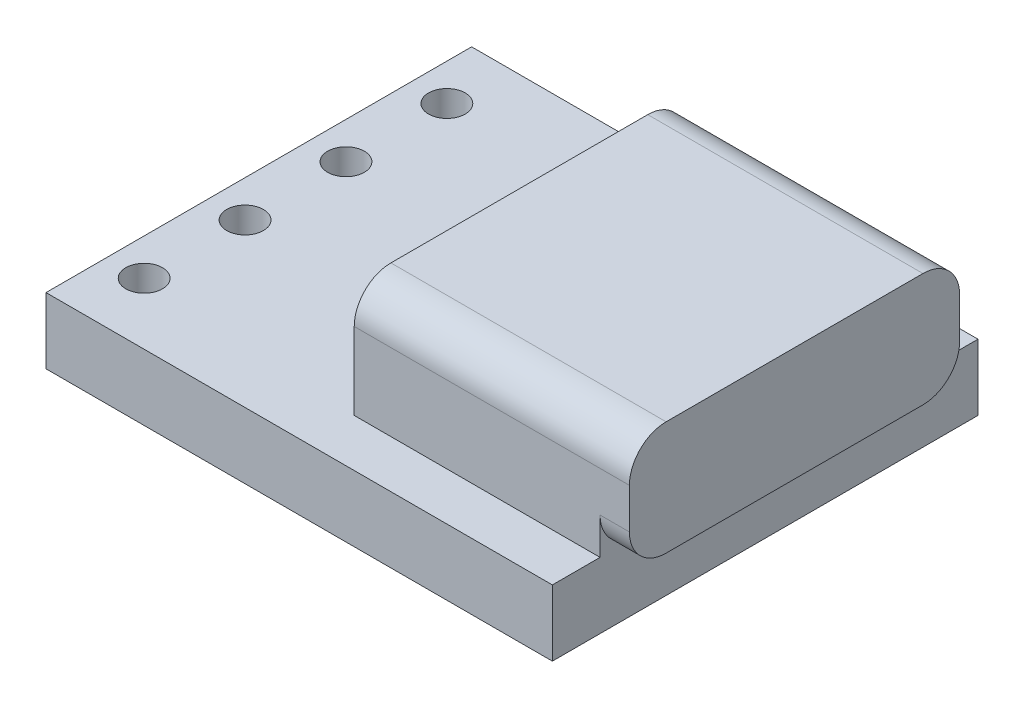
from build123d import *

# Parameters (mm, degrees)
SKETCH_1_W          = 13.8
SKETCH_1_H          = 11.6
EXTRUDE_1_DEPTH     = 1.8
EXTRUDE_START       = -1.8
SKETCH_4_W          = 7.5
SKETCH_4_H          = 9
EXTRUDE_2_DEPTH     = 4.9
SKETCH_5_W          = 9
SKETCH_5_H          = 1.8
CUT_EXTRUDE_1_DEPTH = 0.8
FILLET_1_R          = 1
CUT_EXTRUDE_2_REACH = 12.126
SKETCH_6_R          = 0.5


with BuildPart() as part:
    # 草图1 → 凸台-拉伸1 (new body)
    with BuildSketch(Plane(origin=(0, 0, 0), x_dir=(1, 0, 0), z_dir=(0, 1, 0))):
        Rectangle(SKETCH_1_W, SKETCH_1_H)
    extrude(amount=EXTRUDE_1_DEPTH)

    # 草图4 → 凸台-拉伸2 (add)
    with BuildSketch(Plane(origin=(0, 1.8, 0), x_dir=(1, 0, 0), z_dir=(0, 1, 0)).offset(EXTRUDE_START)):
        with Locations((3.95, 0)):
            Rectangle(SKETCH_4_W, SKETCH_4_H)
    extrude(amount=EXTRUDE_2_DEPTH)

    # 草图5 → 切除-拉伸1 (cut)
    with BuildSketch(Plane(origin=(7.7, 0, 0), x_dir=(0, 0, -1), z_dir=(1, 0, 0))):
        with Locations((0, 0.9)):
            Rectangle(SKETCH_5_W, SKETCH_5_H)
    extrude(amount=-CUT_EXTRUDE_1_DEPTH, mode=Mode.SUBTRACT)

    # 圆角1
    fillet_1_edges = [part.edges().sort_by_distance(p)[0] for p in [
        (3.95, 4.9, 4.5),
        (3.95, 4.9, -4.5),
        (7.3, 1.8, -4.5),
        (7.3, 1.8, 4.5),
    ]]
    fillet(fillet_1_edges, radius=FILLET_1_R)

    # 草图6 → 切除-拉伸2 (cut, up to next)
    with BuildSketch(Plane(origin=(0, 1.8, 0), x_dir=(1, 0, 0), z_dir=(0, 1, 0)), mode=Mode.PRIVATE) as cut_extrude_2_sk1:
        with Locations(Location((-5.9, 4.125, 0), (0, 0, 270))):
            Circle(SKETCH_6_R)
    cut_extrude_2_tool1 = extrude(cut_extrude_2_sk1.sketch, amount=-CUT_EXTRUDE_2_REACH, mode=Mode.PRIVATE) & part.part
    # 草图6 → 切除-拉伸2 (cut, up to next)
    with BuildSketch(Plane(origin=(0, 1.8, 0), x_dir=(1, 0, 0), z_dir=(0, 1, 0)), mode=Mode.PRIVATE) as cut_extrude_2_sk2:
        with Locations(Location((-5.9, 1.375, 0), (0, 0, 270))):
            Circle(SKETCH_6_R)
    cut_extrude_2_tool2 = extrude(cut_extrude_2_sk2.sketch, amount=-CUT_EXTRUDE_2_REACH, mode=Mode.PRIVATE) & part.part
    # 草图6 → 切除-拉伸2 (cut, up to next)
    with BuildSketch(Plane(origin=(0, 1.8, 0), x_dir=(1, 0, 0), z_dir=(0, 1, 0)), mode=Mode.PRIVATE) as cut_extrude_2_sk3:
        with Locations(Location((-5.9, -1.375, 0), (0, 0, 270))):
            Circle(SKETCH_6_R)
    cut_extrude_2_tool3 = extrude(cut_extrude_2_sk3.sketch, amount=-CUT_EXTRUDE_2_REACH, mode=Mode.PRIVATE) & part.part
    # 草图6 → 切除-拉伸2 (cut, up to next)
    with BuildSketch(Plane(origin=(0, 1.8, 0), x_dir=(1, 0, 0), z_dir=(0, 1, 0)), mode=Mode.PRIVATE) as cut_extrude_2_sk4:
        with Locations(Location((-5.9, -4.125, 0), (0, 0, 270))):
            Circle(SKETCH_6_R)
    cut_extrude_2_tool4 = extrude(cut_extrude_2_sk4.sketch, amount=-CUT_EXTRUDE_2_REACH, mode=Mode.PRIVATE) & part.part
    add(cut_extrude_2_tool1.solids().sort_by_distance((-5.9, 1.8, -4.125))[0], mode=Mode.SUBTRACT)
    add(cut_extrude_2_tool2.solids().sort_by_distance((-5.9, 1.8, -1.375))[0], mode=Mode.SUBTRACT)
    add(cut_extrude_2_tool3.solids().sort_by_distance((-5.9, 1.8, 1.375))[0], mode=Mode.SUBTRACT)
    add(cut_extrude_2_tool4.solids().sort_by_distance((-5.9, 1.8, 4.125))[0], mode=Mode.SUBTRACT)


solid = part.part
